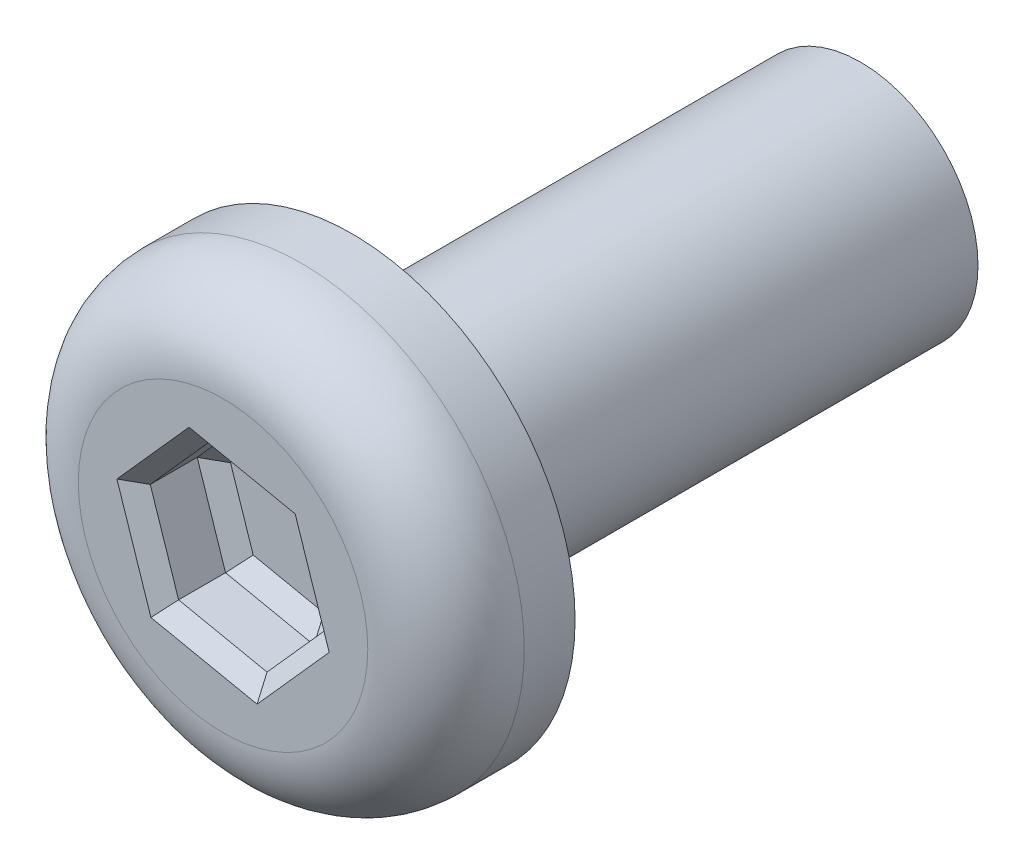
from build123d import *

# Parameters (mm, degrees)
SKETCH_1_R          = 2.85
EXTRUDE_1_DEPTH     = 1.65
SKETCH_2_R          = 1.5
EXTRUDE_2_DEPTH     = 6.5
FILLET_1_R          = 1
CUT_EXTRUDE_1_DEPTH = 1
CHAMFER_1_SIZE      = 0.2


with BuildPart() as part:
    # 草图1 → 凸台-拉伸1 (new body)
    with BuildSketch(Plane.XY):
        Circle(SKETCH_1_R)
    extrude(amount=EXTRUDE_1_DEPTH)

    # 草图2 → 凸台-拉伸2 (add)
    with BuildSketch(Plane(origin=(0, 0, 0), x_dir=(-1, 0, 0), z_dir=(0, 0, -1))):
        with Locations(Location((0, 0, 0), (0, 0, 180))):
            Circle(SKETCH_2_R)
    extrude(amount=EXTRUDE_2_DEPTH)

    # 圆角1
    fillet_1_edges = [part.edges().sort_by_distance(p)[0] for p in [
        (-2.85, 0, 1.65),
    ]]
    fillet(fillet_1_edges, radius=FILLET_1_R)

    # 草图3 → 切除-拉伸1 (cut)
    with BuildSketch(Plane.XY.offset(1.65)):
        Polygon((0.362222341, -1.09641612), (1.130635384, -0.234514311), (0.768413043, 0.861901809), (-0.362222341, 1.09641612), (-1.130635384, 0.234514311), (-0.768413043, -0.861901809), align=None)
    extrude(amount=-CUT_EXTRUDE_1_DEPTH, mode=Mode.SUBTRACT)

    # 倒角1
    chamfer_1_edges = [part.edges().sort_by_distance(p)[0] for p in [
        (-0.203095351, -0.979158965, 0.65),
        (-0.949524213, -0.313693749, 0.65),
        (-0.746428862, 0.665465216, 0.65),
        (0.203095351, 0.979158965, 0.65),
        (0.949524213, 0.313693749, 0.65),
        (0.746428862, -0.665465216, 0.65),
        (-0.203095351, -0.979158965, 1.65),
        (0.746428862, -0.665465216, 1.65),
        (0.949524213, 0.313693749, 1.65),
        (0.203095351, 0.979158965, 1.65),
        (-0.746428862, 0.665465216, 1.65),
        (-0.949524213, -0.313693749, 1.65),
    ]]
    chamfer(chamfer_1_edges, length=CHAMFER_1_SIZE)


solid = part.part
